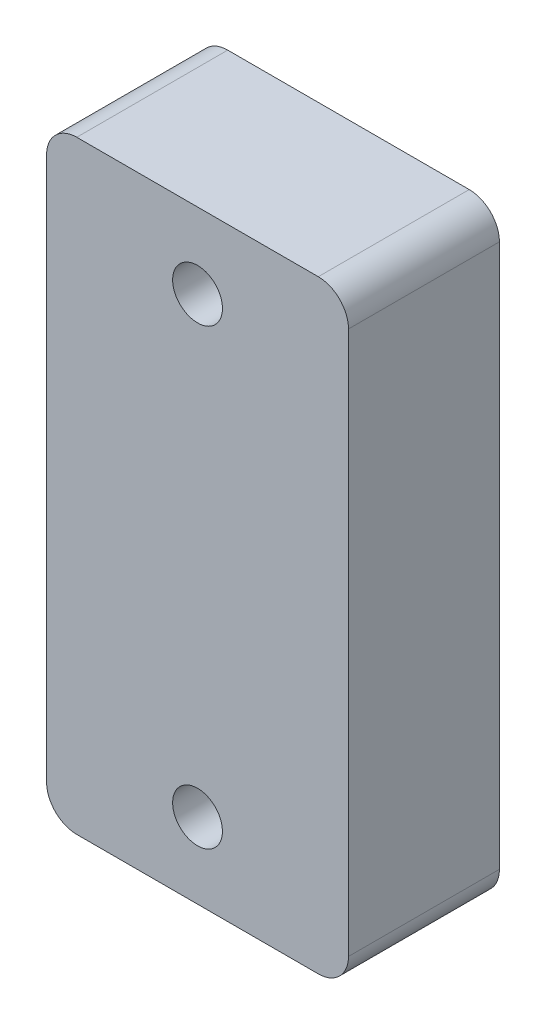
from build123d import *

# Parameters (mm, degrees)
SKETCH_1_W      = 20
SKETCH_1_H      = 40
SKETCH_1_R      = 1.65
EXTRUDE_1_DEPTH = 10
FILLET_1_R      = 2


with BuildPart() as part:
    # 草图1 → 凸台-拉伸1 (new body)
    with BuildSketch(Plane.XY):
        Rectangle(SKETCH_1_W, SKETCH_1_H)
        with Locations((0, 15)):
            Circle(SKETCH_1_R, mode=Mode.SUBTRACT)
        with Locations(Location((0, -15, 0), (0, 0, 180))):
            Circle(SKETCH_1_R, mode=Mode.SUBTRACT)
    extrude(amount=EXTRUDE_1_DEPTH)

    # 圆角1
    fillet_1_edges = [part.edges().sort_by_distance(p)[0] for p in [
        (10, -20, 5),
        (-10, -20, 5),
        (-10, 20, 5),
        (10, 20, 5),
    ]]
    fillet(fillet_1_edges, radius=FILLET_1_R)


solid = part.part
